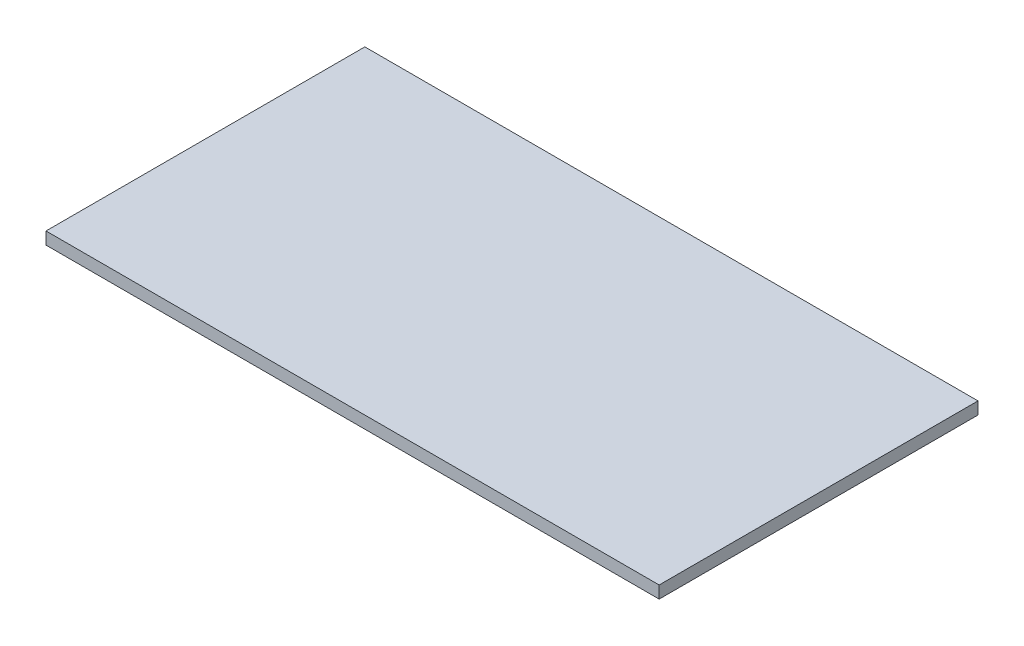
from build123d import *

# Parameters (mm, degrees)
SKETCH1_W           = 200
SKETCH1_H           = 104
BOSS_EXTRUDE1_DEPTH = 4


with BuildPart() as part:
    # Sketch1 → Boss-Extrude1 (new body)
    with BuildSketch(Plane(origin=(0, 0, 0), x_dir=(1, 0, 0), z_dir=(0, 1, 0))):
        with Locations((100, 52)):
            Rectangle(SKETCH1_W, SKETCH1_H)
    extrude(amount=BOSS_EXTRUDE1_DEPTH)


solid = part.part
